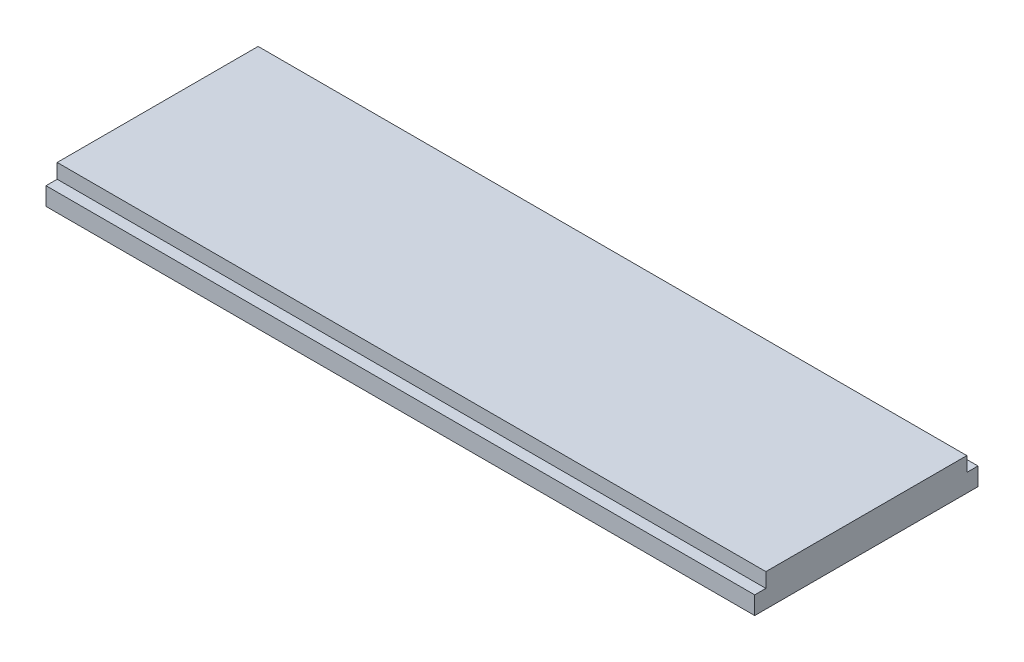
from build123d import *

# Parameters (mm, degrees)
SKETCH1_W           = 1460
SKETCH1_H           = 460
BOSS_EXTRUDE1_DEPTH = 67
SKETCH2_W           = 1460
SKETCH2_H           = 23
CUT_EXTRUDE1_DEPTH  = 30


with BuildPart() as part:
    # Sketch1 → Boss-Extrude1 (new body)
    with BuildSketch(Plane(origin=(0, 0, 0), x_dir=(1, 0, 0), z_dir=(0, 1, 0))):
        with Locations((730, 230)):
            Rectangle(SKETCH1_W, SKETCH1_H)
    extrude(amount=BOSS_EXTRUDE1_DEPTH)

    # Sketch2 → Cut-Extrude1 (cut)
    with BuildSketch(Plane(origin=(0, 67, 0), x_dir=(1, 0, 0), z_dir=(0, 1, 0))):
        with Locations((730, 11.5)):
            Rectangle(SKETCH2_W, SKETCH2_H)
        with Locations((730, 448.5)):
            Rectangle(SKETCH2_W, SKETCH2_H)
    extrude(amount=-CUT_EXTRUDE1_DEPTH, mode=Mode.SUBTRACT)


solid = part.part
